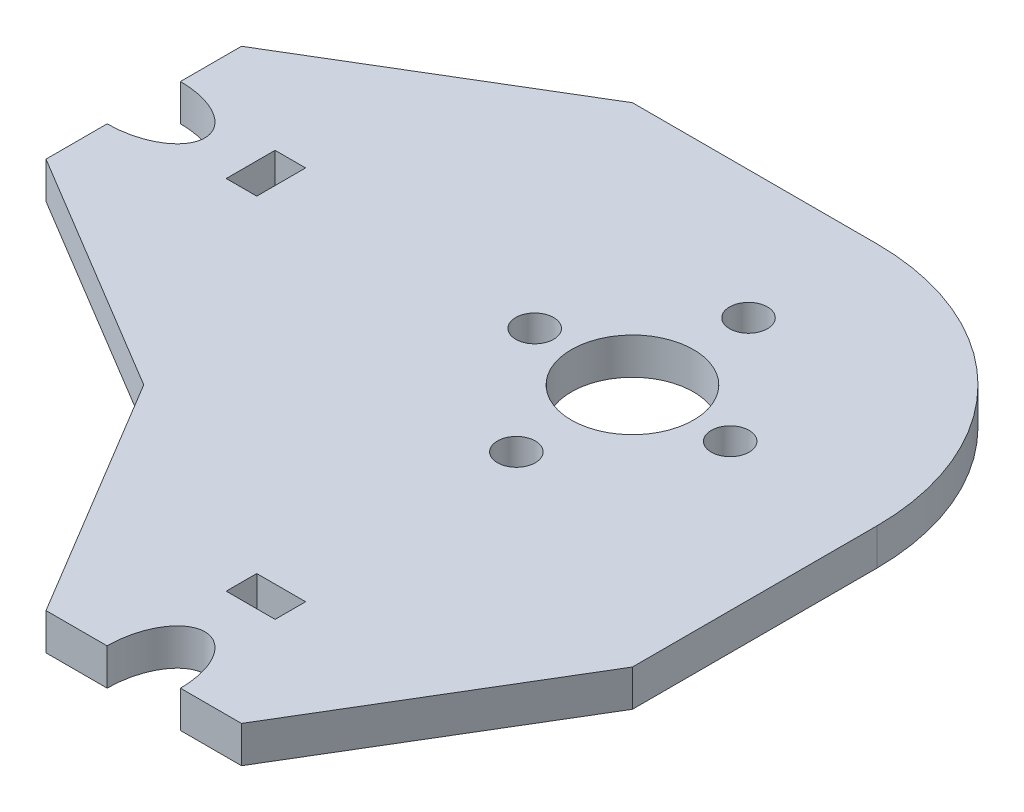
from build123d import *

# Parameters (mm, degrees)
SKETCH_2_R      = 5
SKETCH_2_R_2    = 1.55
SKETCH_2_W      = 4
SKETCH_2_H      = 2.5
SKETCH_2_W_2    = 2.5
SKETCH_2_H_2    = 4
EXTRUDE_1_DEPTH = 3


with BuildPart() as part:
    # 草圖2 → 填料-伸長1 (new body)
    with BuildSketch(Plane(origin=(0, 0, 0), x_dir=(1, 0, 0), z_dir=(0, 1, 0))):
        with BuildLine():
            Line((-40, 3), (-40, 8))
            Line((-40, 8), (-20, 20))
            Line((-20, 20), (0, 20))
            ThreePointArc((0, 20), (14.142135624, 14.142135624), (20, 0))
            Line((20, 0), (20, -20))
            Line((20, -20), (8, -40))
            Line((8, -40), (3, -40))
            add(Edge.make_bspline(
                [(3, -40), (3, -35), (0, -35), (-3, -35), (-3, -40)],
                knots=[1.570796327, 1.570796327, 1.570796327, 3.141592654, 3.141592654, 4.71238898, 4.71238898, 4.71238898], degree=2, weights=[1, 0.707106781, 1, 0.707106781, 1]))
            Line((-3, -40), (-8, -40))
            Line((-8, -40), (-20, -20))
            Line((-20, -20), (-40, -8))
            Line((-40, -8), (-40, -3))
            add(Edge.make_bspline(
                [(-40, -3), (-35, -3), (-35, 0), (-35, 3), (-40, 3)],
                knots=[4.71238898, 4.71238898, 4.71238898, 6.283185307, 6.283185307, 7.853981634, 7.853981634, 7.853981634], degree=2, weights=[1, 0.707106781, 1, 0.707106781, 1]))
        make_face()
        with Locations(Location((0, 0, 0), (0, 0, 270))):
            Circle(SKETCH_2_R, mode=Mode.SUBTRACT)
        with Locations(Location((8, 0, 0), (0, 0, 270))):
            Circle(SKETCH_2_R_2, mode=Mode.SUBTRACT)
        with Locations(Location((0, -9.5, 0), (0, 0, 270))):
            Circle(SKETCH_2_R_2, mode=Mode.SUBTRACT)
        with Locations(Location((-8, 0, 0), (0, 0, 270))):
            Circle(SKETCH_2_R_2, mode=Mode.SUBTRACT)
        with Locations(Location((0, 9.5, 0), (0, 0, 270))):
            Circle(SKETCH_2_R_2, mode=Mode.SUBTRACT)
        with Locations((0, -30)):
            Rectangle(SKETCH_2_W, SKETCH_2_H, mode=Mode.SUBTRACT)
        with Locations((-30, 0)):
            Rectangle(SKETCH_2_W_2, SKETCH_2_H_2, mode=Mode.SUBTRACT)
    extrude(amount=EXTRUDE_1_DEPTH)


solid = part.part
